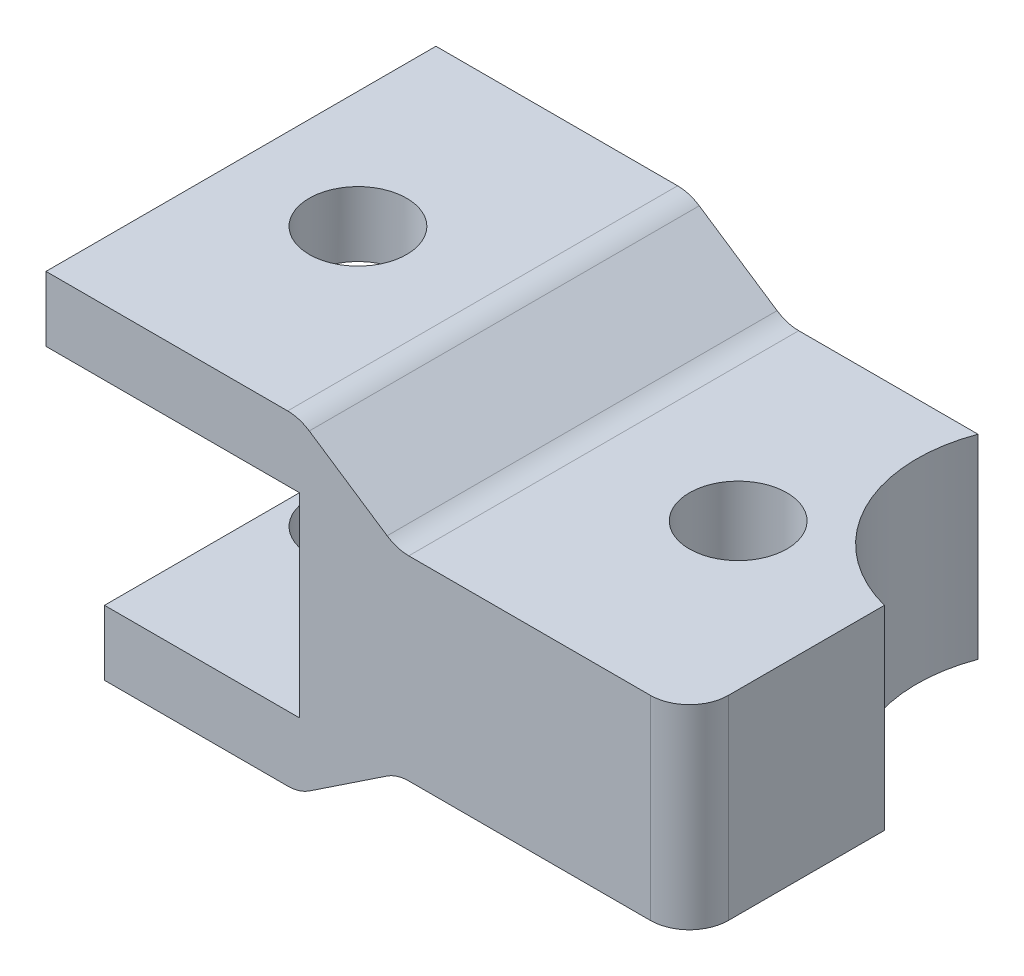
from build123d import *

# Parameters (mm, degrees)
SKETCH1_W               = 12.7
SKETCH1_H               = 4.23164
SKETCH1_W_2             = 16.51
BOSS_EXTRUDE1_DEPTH     = 25.4
CUT_EXTRUDE4_DEPTH      = 49.820594354
CUT_EXTRUDE4_DEPTH_BACK = 49.820594354
SKETCH4_R               = 3.175
CUT_EXTRUDE5_DEPTH      = 49.820594354
CUT_EXTRUDE5_DEPTH_BACK = 49.820594354
SKETCH6_R               = 3.175
CUT_EXTRUDE6_DEPTH      = 49.820594354
CUT_EXTRUDE6_DEPTH_BACK = 49.820594354
FILLET1_R               = 2.54


with BuildPart() as part:
    # Sketch1 → Boss-Extrude1 (new body)
    with BuildSketch(Plane.XY):
        with Locations((6.35, -2.11582)):
            Rectangle(SKETCH1_W, SKETCH1_H)
        Polygon((19.05, 0), (38.1, 0), (38.1, 12.7), (19.05, 12.7), (12.7, 16.93164), (12.7, 12.7), (12.7, 0), (12.7, -4.23164), align=None)
        with Locations((4.445, 14.81582)):
            Rectangle(SKETCH1_W_2, SKETCH1_H)
    extrude(amount=BOSS_EXTRUDE1_DEPTH)

    # Sketch4 → Cut-Extrude4 (cut, two sides: drawn at the far end of the back side and taken through both)
    with BuildSketch(Plane(origin=(0, 0, 0), x_dir=(1, 0, 0), z_dir=(0, 1, 0)).offset(-CUT_EXTRUDE4_DEPTH_BACK)):
        with Locations(Location((3.81, -12.7, 0), (0, 0, 270))):
            Circle(SKETCH4_R)
    extrude(amount=CUT_EXTRUDE4_DEPTH + CUT_EXTRUDE4_DEPTH_BACK, mode=Mode.SUBTRACT)

    # Sketch6 → Cut-Extrude5 (cut, two sides: drawn at the far end of the back side and taken through both)
    with BuildSketch(Plane(origin=(0, 12.7, 0), x_dir=(1, 0, 0), z_dir=(0, 1, 0)).offset(-CUT_EXTRUDE5_DEPTH_BACK)):
        with Locations(Location((28.575, -12.7, 0), (0, 0, 270))):
            Circle(SKETCH6_R)
    extrude(amount=CUT_EXTRUDE5_DEPTH + CUT_EXTRUDE5_DEPTH_BACK, mode=Mode.SUBTRACT)

    # Sketch7 → Cut-Extrude6 (cut, two sides: drawn at the far end of the back side and taken through both)
    with BuildSketch(Plane(origin=(0, 12.7, 0), x_dir=(1, 0, 0), z_dir=(0, 1, 0)).offset(-CUT_EXTRUDE6_DEPTH_BACK)):
        with BuildLine():
            Line((31.497009702, 0), (38.1, 0))
            Line((38.1, 0), (38.1, -12.7))
            ThreePointArc((38.1, -12.7), (31.974019773, -7.818507683), (31.497009702, 0))
        make_face()
    extrude(amount=CUT_EXTRUDE6_DEPTH + CUT_EXTRUDE6_DEPTH_BACK, mode=Mode.SUBTRACT)

    # Fillet1
    fillet1_edges = [part.edges().sort_by_distance(p)[0] for p in [
        (12.7, 16.93164, 12.7),
        (19.05, 12.7, 12.7),
        (19.05, 0, 12.7),
        (12.7, -4.23164, 12.7),
        (38.1, 6.35, 25.4),
    ]]
    fillet(fillet1_edges, radius=FILLET1_R)


solid = part.part
